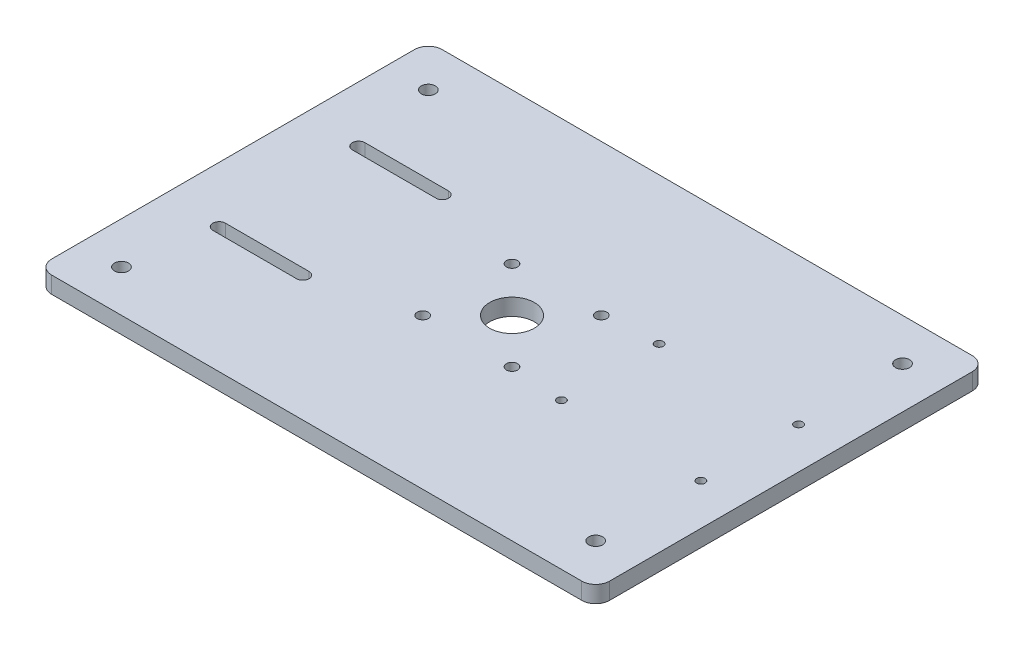
from build123d import *

# Parameters (mm, degrees)
SKETCH2_W           = 200
SKETCH2_H           = 140
BOSS_EXTRUDE1_DEPTH = 6
FILLET1_R           = 5
SKETCH3_R           = 2.5
CUT_EXTRUDE1_DEPTH  = 123.21292894
SKETCH4_R           = 8
CUT_EXTRUDE2_DEPTH  = 123.21292894
SKETCH5_R           = 2
CUT_EXTRUDE3_DEPTH  = 123.21292894
CUT_EXTRUDE4_DEPTH  = 123.21292894
SKETCH7_R           = 1.5
CUT_EXTRUDE5_DEPTH  = 123.21292894


with BuildPart() as part:
    # Sketch2 → Boss-Extrude1 (new body)
    with BuildSketch(Plane(origin=(0, 0, 0), x_dir=(1, 0, 0), z_dir=(0, 1, 0))):
        Rectangle(SKETCH2_W, SKETCH2_H)
    extrude(amount=BOSS_EXTRUDE1_DEPTH)

    # Fillet1
    fillet1_edges = [part.edges().sort_by_distance(p)[0] for p in [
        (100, 3, 70),
        (-100, 3, 70),
        (-100, 3, -70),
        (100, 3, -70),
    ]]
    fillet(fillet1_edges, radius=FILLET1_R)

    # Sketch3 → Cut-Extrude1 (cut, through all)
    with BuildSketch(Plane(origin=(0, 6, 0), x_dir=(1, 0, 0), z_dir=(0, 1, 0))):
        with Locations(Location((-85, 55, 0), (0, 0, 270))):
            Circle(SKETCH3_R)
        with Locations(Location((-85, -55, 0), (0, 0, 90))):
            Circle(SKETCH3_R)
        with Locations(Location((85, -55, 0), (0, 0, 270))):
            Circle(SKETCH3_R)
        with Locations(Location((85, 55, 0), (0, 0, 90))):
            Circle(SKETCH3_R)
    extrude(amount=-CUT_EXTRUDE1_DEPTH, mode=Mode.SUBTRACT)

    # Sketch4 → Cut-Extrude2 (cut, through all)
    with BuildSketch(Plane(origin=(0, 6, 0), x_dir=(1, 0, 0), z_dir=(0, 1, 0))):
        with Locations(Location((0, 0, 0), (0, 0, 270))):
            Circle(SKETCH4_R)
    extrude(amount=-CUT_EXTRUDE2_DEPTH, mode=Mode.SUBTRACT)

    # Sketch5 → Cut-Extrude3 (cut, through all)
    with BuildSketch(Plane(origin=(0, 6, 0), x_dir=(1, 0, 0), z_dir=(0, 1, 0))):
        with Locations(Location((16, 16, 0), (0, 0, 270))):
            Circle(SKETCH5_R)
        with Locations(Location((16, -16, 0), (0, 0, 270))):
            Circle(SKETCH5_R)
        with Locations(Location((-16, -16, 0), (0, 0, 270))):
            Circle(SKETCH5_R)
        with Locations(Location((-16, 16, 0), (0, 0, 270))):
            Circle(SKETCH5_R)
    extrude(amount=-CUT_EXTRUDE3_DEPTH, mode=Mode.SUBTRACT)

    # Sketch6 → Cut-Extrude4 (cut, through all)
    with BuildSketch(Plane(origin=(0, 6, 0), x_dir=(1, 0, 0), z_dir=(0, 1, 0))):
        with BuildLine():
            Line((-80, 27.25), (-50, 27.25))
            ThreePointArc((-50, 27.25), (-47.75, 25), (-50, 22.75))
            Line((-50, 22.75), (-80, 22.75))
            ThreePointArc((-80, 22.75), (-82.25, 25), (-80, 27.25))
        make_face()
        with BuildLine():
            Line((-80, -22.75), (-50, -22.75))
            ThreePointArc((-50, -22.75), (-47.75, -25), (-50, -27.25))
            Line((-50, -27.25), (-80, -27.25))
            ThreePointArc((-80, -27.25), (-82.25, -25), (-80, -22.75))
        make_face()
    extrude(amount=-CUT_EXTRUDE4_DEPTH, mode=Mode.SUBTRACT)

    # Sketch7 → Cut-Extrude5 (cut, through all)
    with BuildSketch(Plane(origin=(0, 6, 0), x_dir=(1, 0, 0), z_dir=(0, 1, 0))):
        with Locations(Location((35.22226737, -17.5, 0), (0, 0, 270))):
            Circle(SKETCH7_R)
        with Locations(Location((35.22226737, 17.5, 0), (0, 0, 270))):
            Circle(SKETCH7_R)
        with Locations(Location((85.22226737, 17.5, 0), (0, 0, 270))):
            Circle(SKETCH7_R)
        with Locations(Location((85.22226737, -17.5, 0), (0, 0, 270))):
            Circle(SKETCH7_R)
    extrude(amount=-CUT_EXTRUDE5_DEPTH, mode=Mode.SUBTRACT)


solid = part.part
